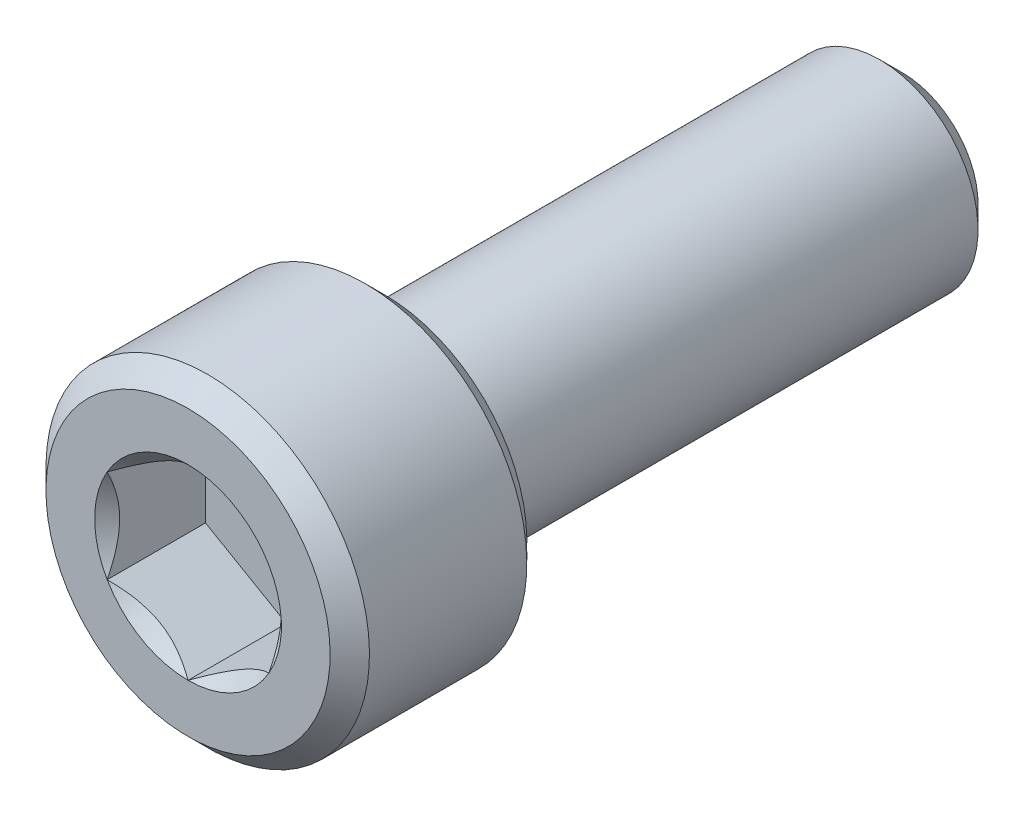
from build123d import *

# Parameters (mm, degrees)
CUT_EXTRUDE1_DEPTH = 2.413


with BuildPart() as part:
    # Sketch3 → Revolve1 (revolve)
    with BuildSketch(Plane(origin=(0, 0, 0), x_dir=(0, 0, -1), z_dir=(1, 0, 0))):
        Polygon((8.763, 0), (-8.763, 0), (-8.763, 3.48615), (-8.2804, 3.96875), (-4.4196, 3.96875), (-3.937, 3.48615), (-3.937, 2.413), (8.207375, 2.413), (8.763, 1.857375), align=None)
    revolve(axis=Axis((0, 0, -8.763), (0, 0, 1)))

    # Sketch4 → Cut-Extrude1 (cut)
    with BuildSketch(Plane.XY.offset(8.763)):
        Polygon((0, -2.291358881), (1.984375, -1.14567944), (1.984375, 1.14567944), (0, 2.291358881), (-1.984375, 1.14567944), (-1.984375, -1.14567944), align=None)
    extrude(amount=-CUT_EXTRUDE1_DEPTH, mode=Mode.SUBTRACT)

    # Cut-Extrude3 cone 1 section (through the dimple's axis) → Cut-Extrude3 (revolve, cut)
    with BuildSketch(Plane(origin=(0, 0, 8.763), x_dir=(0, -1, 0), z_dir=(1, 0, 0))):
        Polygon((0, 0), (2.291358881, 0), (0, 2.291358881), align=None)
    revolve(axis=Axis((0, 0, 8.763), (0, 0, -1)), mode=Mode.SUBTRACT)


solid = part.part
